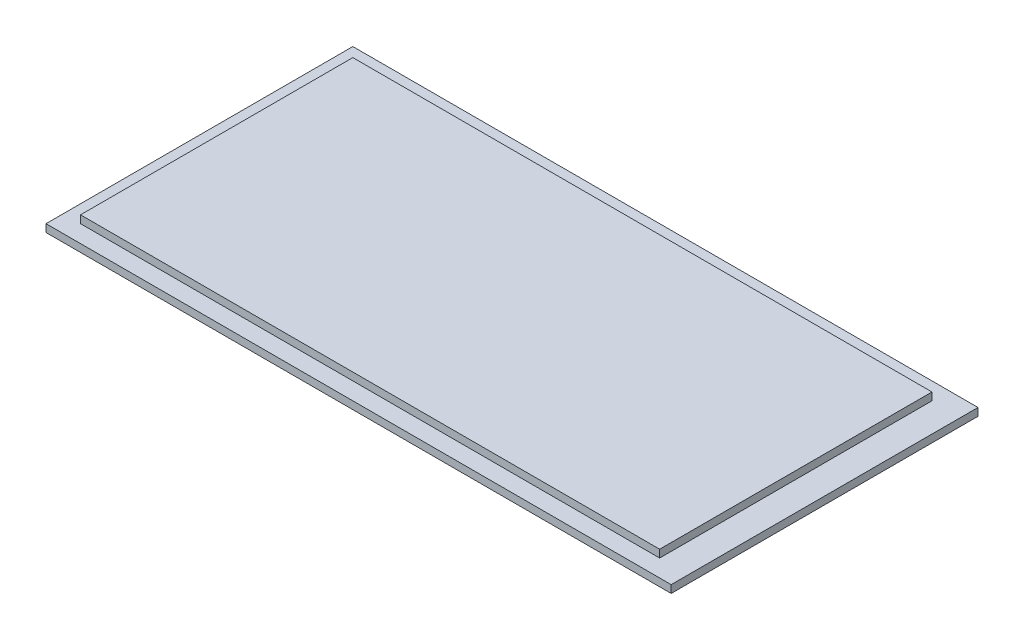
from build123d import *

# Parameters (mm, degrees)
IZIM1_W                     = 163
IZIM1_H                     = 80
Y_KSEKLIK_EKSTR_ZYON1_DEPTH = 2
IZIM2_W                     = 151
IZIM2_H                     = 71
Y_KSEKLIK_EKSTR_ZYON2_DEPTH = 2


with BuildPart() as part:
    # Çizim1 → Yükseklik-Ekstrüzyon1 (new body)
    with BuildSketch(Plane(origin=(0, 0, 0), x_dir=(1, 0, 0), z_dir=(0, 1, 0))):
        Rectangle(IZIM1_W, IZIM1_H)
    extrude(amount=Y_KSEKLIK_EKSTR_ZYON1_DEPTH)

    # Çizim2 → Yükseklik-Ekstrüzyon2 (add)
    with BuildSketch(Plane(origin=(0, 2, 0), x_dir=(1, 0, 0), z_dir=(0, 1, 0))):
        with Locations((-1.5, 0)):
            Rectangle(IZIM2_W, IZIM2_H)
    extrude(amount=Y_KSEKLIK_EKSTR_ZYON2_DEPTH)


solid = part.part
